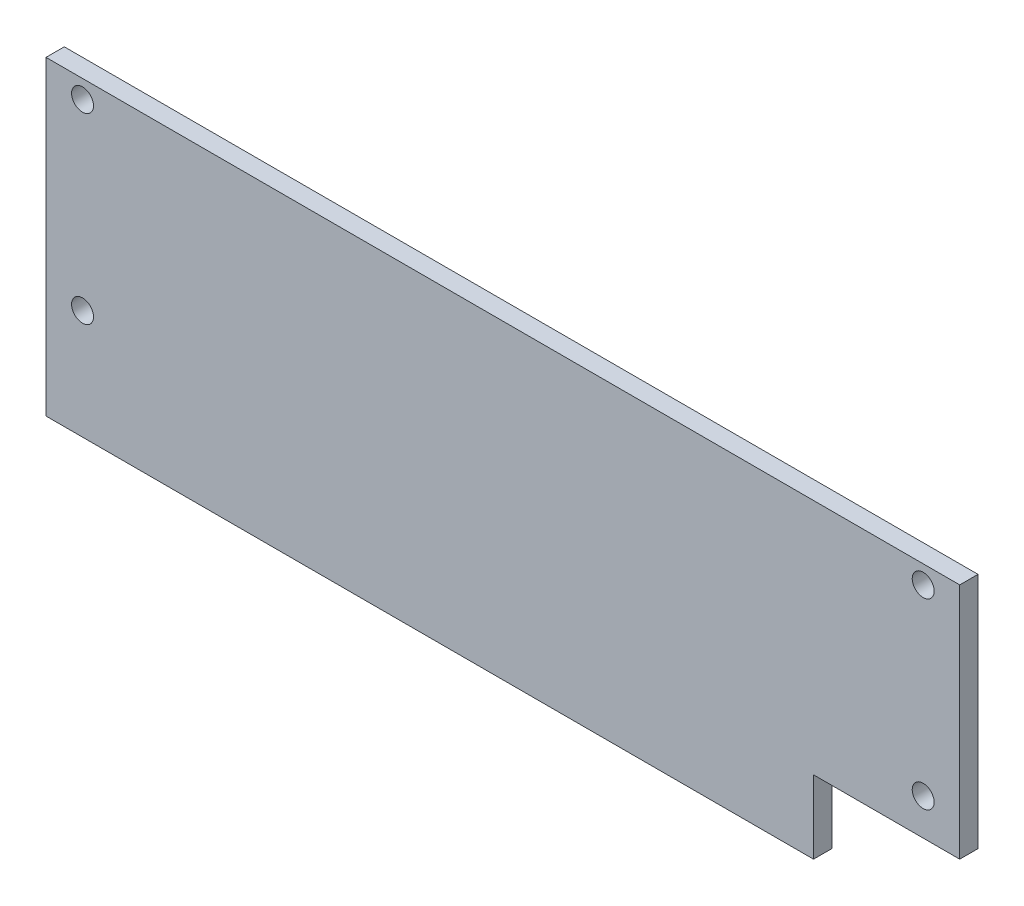
from build123d import *

# Parameters (mm, degrees)
ESQUISSE1_W             = 250
ESQUISSE1_H             = 85
ESQUISSE1_R             = 3
BOSS_EXTRU_1_DEPTH      = 5
ESQUISSE2_W             = 40
ESQUISSE2_H             = 20
ENL_V_MAT_EXTRU_1_DEPTH = 10


with BuildPart() as part:
    # Esquisse1 → Boss.-Extru.1 (new body)
    with BuildSketch(Plane.XY):
        with Locations((125, -42.5)):
            Rectangle(ESQUISSE1_W, ESQUISSE1_H)
        with Locations((10, -5)):
            Circle(ESQUISSE1_R, mode=Mode.SUBTRACT)
        with Locations((10, -55)):
            Circle(ESQUISSE1_R, mode=Mode.SUBTRACT)
        with Locations(Location((240, -55, 0), (0, 0, 180))):
            Circle(ESQUISSE1_R, mode=Mode.SUBTRACT)
        with Locations(Location((240, -5, 0), (0, 0, 180))):
            Circle(ESQUISSE1_R, mode=Mode.SUBTRACT)
    extrude(amount=BOSS_EXTRU_1_DEPTH)

    # Esquisse2 → Enlèv. mat.-Extru.1 (cut)
    with BuildSketch(Plane(origin=(0, 0, 0), x_dir=(-1, 0, 0), z_dir=(0, 0, -1))):
        with Locations((-230, -75)):
            Rectangle(ESQUISSE2_W, ESQUISSE2_H)
    extrude(amount=-ENL_V_MAT_EXTRU_1_DEPTH, mode=Mode.SUBTRACT)


solid = part.part
